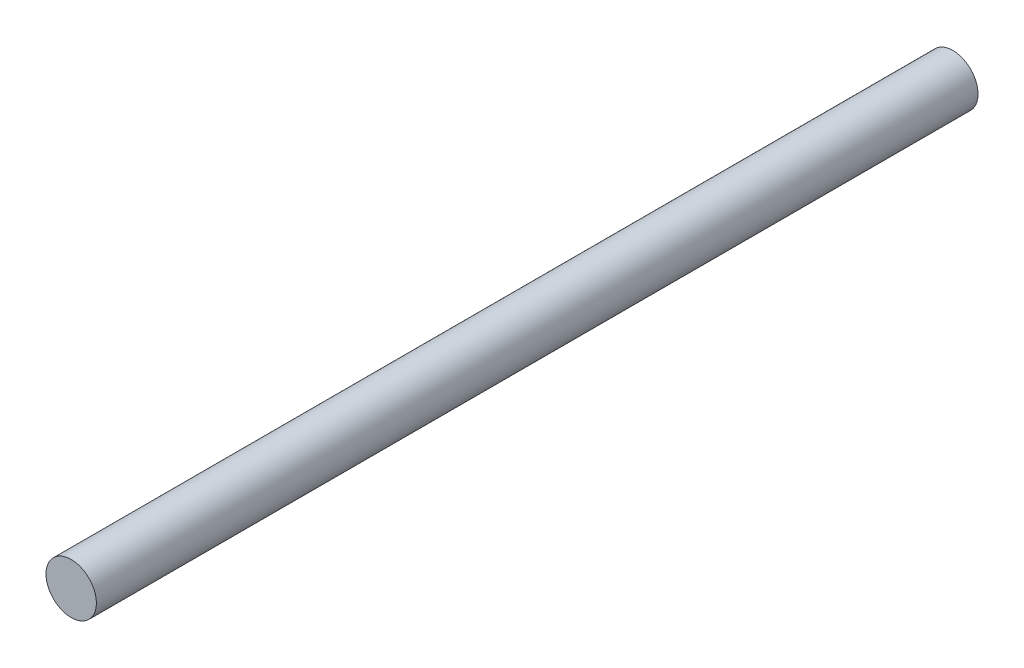
from build123d import *

# Parameters (mm, degrees)
SKETCH1_R           = 4.8
BOSS_EXTRUDE1_DEPTH = 84


with BuildPart() as part:
    # Sketch1 → Boss-Extrude1 (new, symmetric)
    with BuildSketch(Plane.XY):
        with Locations(Location((0, 0, 0), (0, 0, 180))):
            Circle(SKETCH1_R)
    extrude(amount=BOSS_EXTRUDE1_DEPTH, both=True)


solid = part.part
